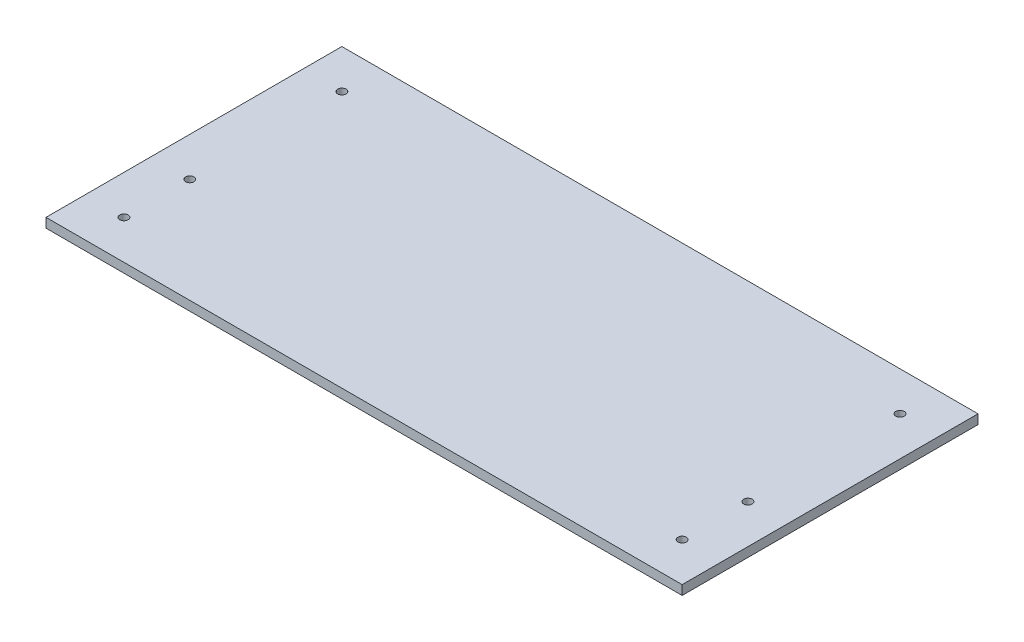
from build123d import *

# Parameters (mm, degrees)
SKETCH1_W           = 215.01
SKETCH1_H           = 100
BOSS_EXTRUDE1_DEPTH = 3.18
SKETCH2_R           = 1.4224
CUT_EXTRUDE1_DEPTH  = 3.18
SKETCH4_R           = 1.4224
CUT_EXTRUDE4_DEPTH  = 3.18


with BuildPart() as part:
    # Sketch1 → Boss-Extrude1 (new body)
    with BuildSketch(Plane(origin=(0, 0, 0), x_dir=(1, 0, 0), z_dir=(0, 1, 0))):
        Rectangle(SKETCH1_W, SKETCH1_H)
    extrude(amount=BOSS_EXTRUDE1_DEPTH)

    # Sketch2 → Cut-Extrude1 (cut)
    with BuildSketch(Plane.XZ):
        with Locations(Location((-94.325, -36.825, 0), (0, 0, 270))):
            Circle(SKETCH2_R)
        with Locations(Location((94.325, -36.82, 0), (0, 0, 270))):
            Circle(SKETCH2_R)
    cut_extrude1 = extrude(amount=-CUT_EXTRUDE1_DEPTH, mode=Mode.SUBTRACT)

    # Mirror1: Cut-Extrude1 across plane
    add(cut_extrude1.mirror(Plane.XY), mode=Mode.SUBTRACT)

    # Sketch4 → Cut-Extrude4 (cut)
    with BuildSketch(Plane.XZ):
        with Locations(Location((-94.325, 14.58, 0), (0, 0, 270))):
            Circle(SKETCH4_R)
        with Locations(Location((94.325, 14.58, 0), (0, 0, 270))):
            Circle(SKETCH4_R)
    extrude(amount=-CUT_EXTRUDE4_DEPTH, mode=Mode.SUBTRACT)


solid = part.part
